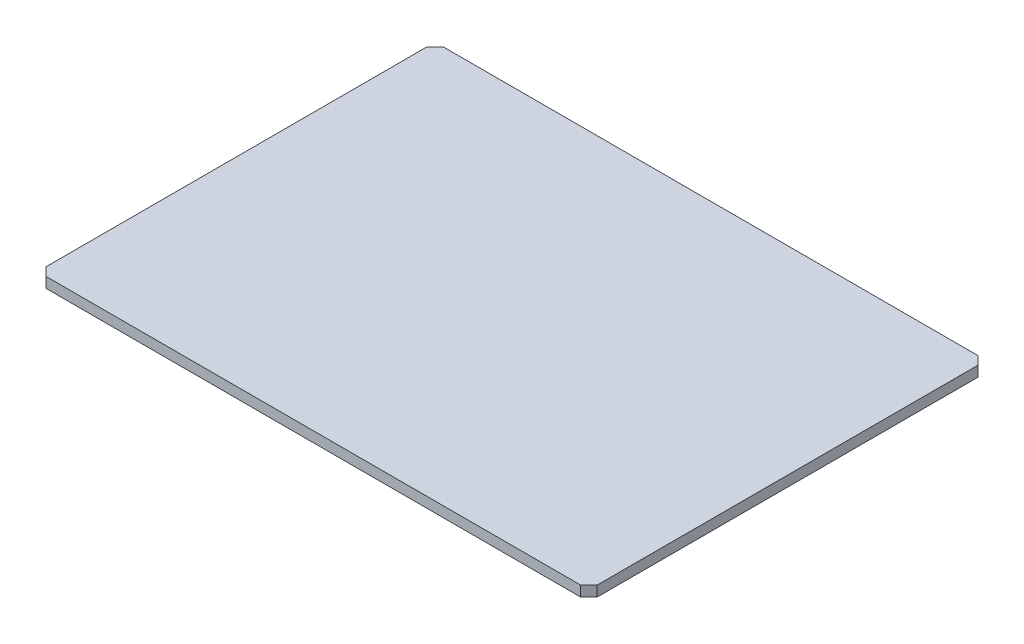
from build123d import *

# Parameters (mm, degrees)
SKETCH2_W           = 132.6
SKETCH2_H           = 95.6
BOSS_EXTRUDE1_DEPTH = 2.5
CHAMFER1_SIZE       = 2
BOSS_EXTRUDE2_DEPTH = 1.3


with BuildPart() as part:
    # Sketch2 → Boss-Extrude1 (new body)
    with BuildSketch(Plane(origin=(0, 0, 0), x_dir=(1, 0, 0), z_dir=(0, 1, 0))):
        Rectangle(SKETCH2_W, SKETCH2_H)
    extrude(amount=BOSS_EXTRUDE1_DEPTH)

    # Chamfer1
    chamfer1_edges = [part.edges().sort_by_distance(p)[0] for p in [
        (66.3, 1.25, 47.8),
        (-66.3, 1.25, 47.8),
        (-66.3, 1.25, -47.8),
        (66.3, 1.25, -47.8),
    ]]
    chamfer(chamfer1_edges, length=CHAMFER1_SIZE)

    # Sketch3 → Boss-Extrude2 (add)
    with BuildSketch(Plane.XZ):
        with BuildLine():
            Line((-58.425, 18.925), (-66.3, 18.925))
            Line((-66.3, 18.925), (-66.3, 8.675))
            Line((-66.3, 8.675), (-58.425, 8.675))
            ThreePointArc((-58.425, 8.675), (-53.3, 13.8), (-58.425, 18.925))
        make_face()
    extrude(amount=BOSS_EXTRUDE2_DEPTH)


solid = part.part
